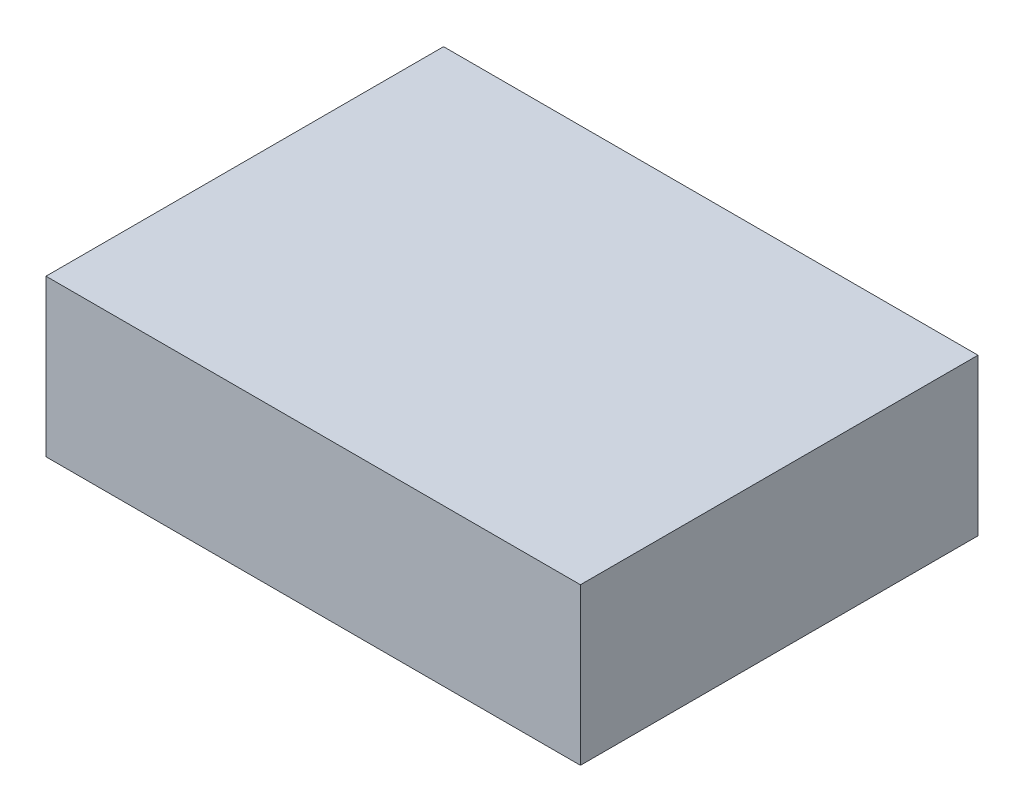
from build123d import *

# Parameters (mm, degrees)
SKETCH1_W           = 260.35
SKETCH1_H           = 193.675
BOSS_EXTRUDE1_DEPTH = 76.2


with BuildPart() as part:
    # Sketch1 → Boss-Extrude1 (new body)
    with BuildSketch(Plane(origin=(0, 0, 0), x_dir=(1, 0, 0), z_dir=(0, 1, 0))):
        Rectangle(SKETCH1_W, SKETCH1_H)
    extrude(amount=BOSS_EXTRUDE1_DEPTH)


solid = part.part
